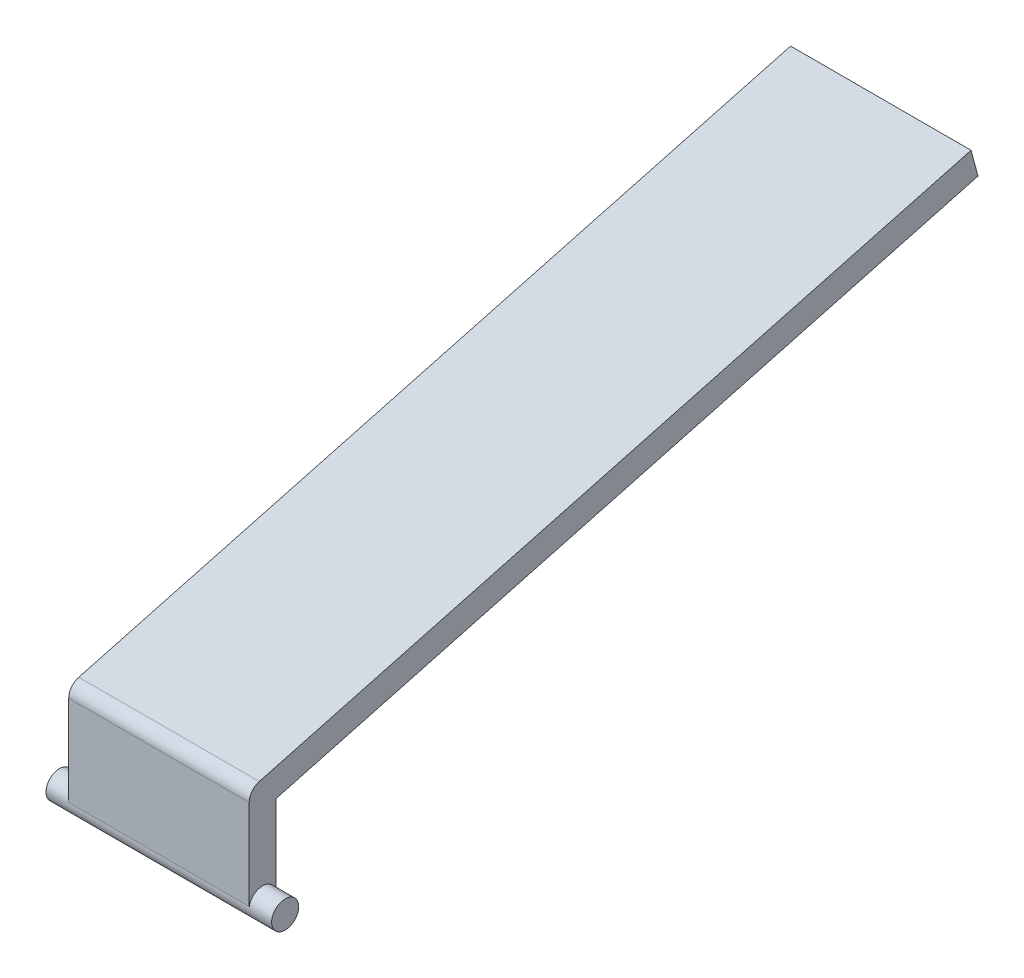
from build123d import *

# Parameters (mm, degrees)
SKETCH1_R                = 0.3
BOSS_EXTRUDE1_DEPTH      = 2.5
BOSS_EXTRUDE2_DEPTH      = 2
BOSS_EXTRUDE2_DEPTH_BACK = 2


with BuildPart() as part:
    # Sketch1 → Boss-Extrude1 (new, symmetric)
    with BuildSketch(Plane(origin=(0, 0, 0), x_dir=(0, 0, -1), z_dir=(1, 0, 0))):
        Circle(SKETCH1_R)
    extrude(amount=BOSS_EXTRUDE1_DEPTH, both=True)

    # Sketch2 → Boss-Extrude2 (add, two sides: drawn at the far end of the back side and taken through both)
    with BuildSketch(Plane(origin=(0, 0, 0), x_dir=(0, 0, -1), z_dir=(1, 0, 0)).offset(-BOSS_EXTRUDE2_DEPTH_BACK)):
        with BuildLine():
            Line((-0.296211166, 0.047528362), (-0.296211166, 2.047528362))
            ThreePointArc((-0.296211166, 2.047528362), (-0.233869415, 2.231181239), (-0.07260959, 2.338931609))
            Line((-0.07260959, 2.338931609), (15.7, 6.565189611))
            Line((15.7, 6.565189611), (15.853330182, 5.992953581))
            Line((15.853330182, 5.992953581), (0.296211166, 1.824436104))
            Line((0.296211166, 1.824436104), (0.296211166, 0.047528362))
            Line((0.296211166, 0.047528362), (-0.296211166, 0.047528362))
        make_face()
    extrude(amount=BOSS_EXTRUDE2_DEPTH + BOSS_EXTRUDE2_DEPTH_BACK)


solid = part.part
